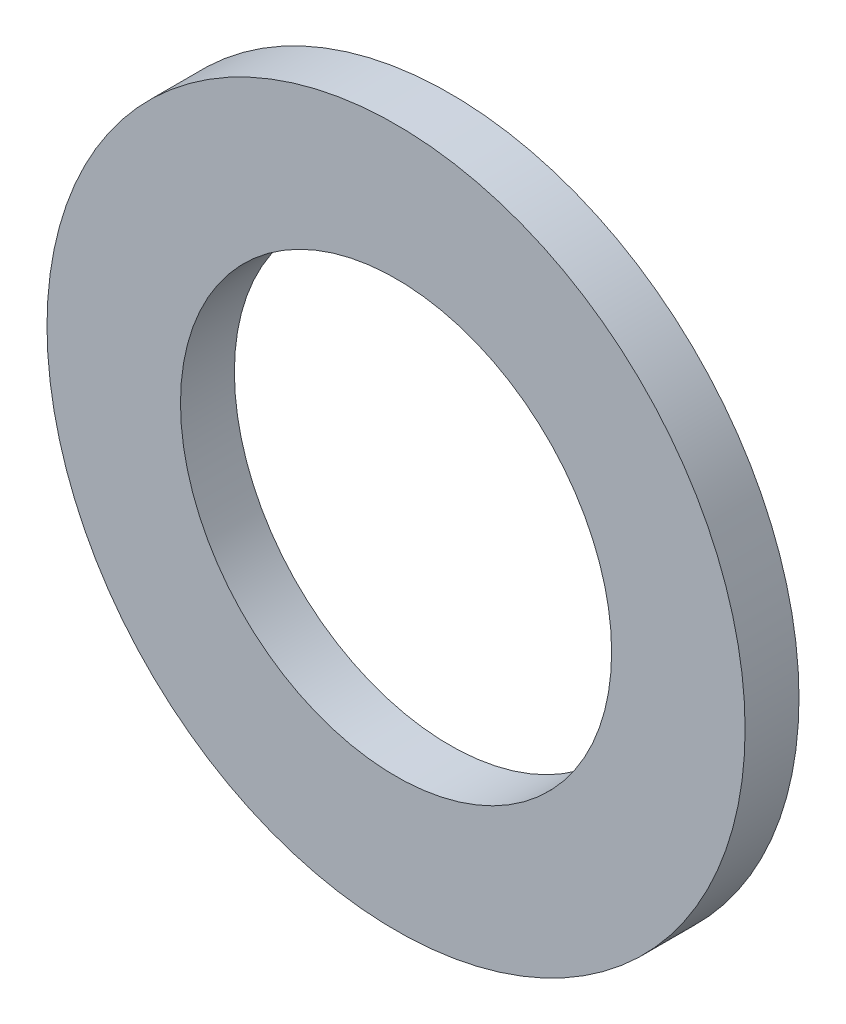
from build123d import *

# Parameters (mm, degrees)
SKETCH1_R           = 32.3845764
SKETCH1_R_2         = 20
BOSS_EXTRUDE1_DEPTH = 5


with BuildPart() as part:
    # Sketch1 → Boss-Extrude1 (new body)
    with BuildSketch(Plane.XY):
        with Locations((-26.007469445, -4.968616707)):
            Circle(SKETCH1_R)
        with Locations((-26.007469445, -4.968616707)):
            Circle(SKETCH1_R_2, mode=Mode.SUBTRACT)
    extrude(amount=BOSS_EXTRUDE1_DEPTH)


solid = part.part
